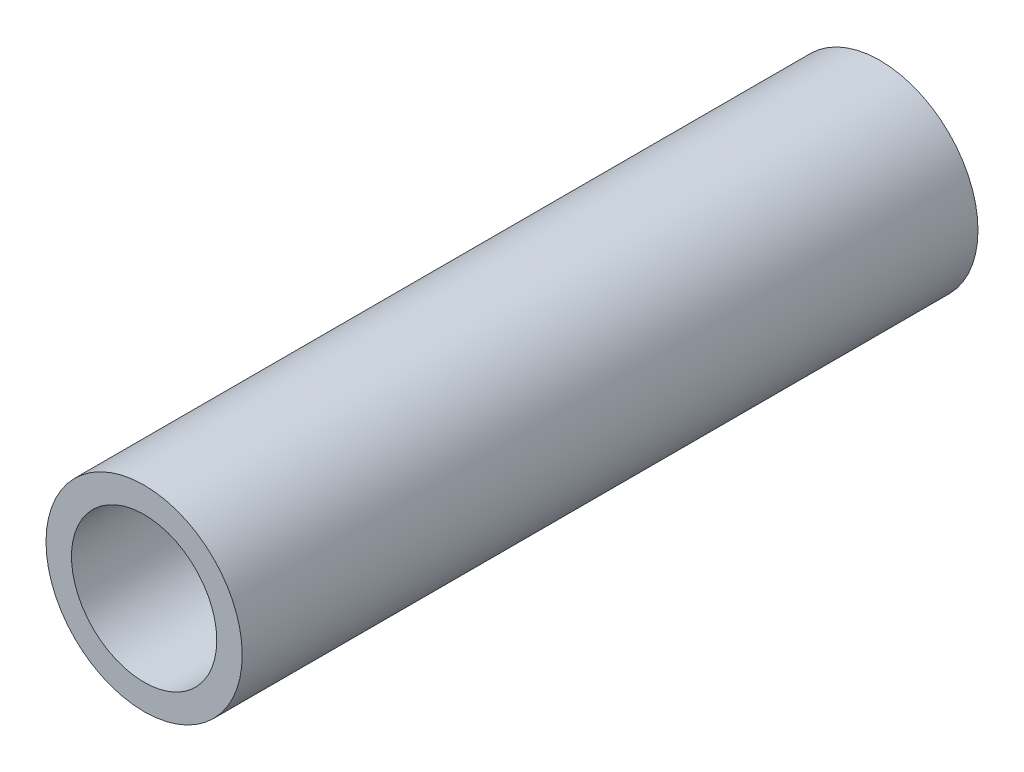
from build123d import *

# Parameters (mm, degrees)
SKETCH1_R           = 10.668
SKETCH1_R_2         = 7.8994
EXTRUDE_THIN1_DEPTH = 40


with BuildPart() as part:
    # Sketch1 → Extrude-Thin1 (new, symmetric)
    with BuildSketch(Plane.XY):
        Circle(SKETCH1_R)
        Circle(SKETCH1_R_2, mode=Mode.SUBTRACT)
    extrude(amount=EXTRUDE_THIN1_DEPTH, both=True)


solid = part.part
